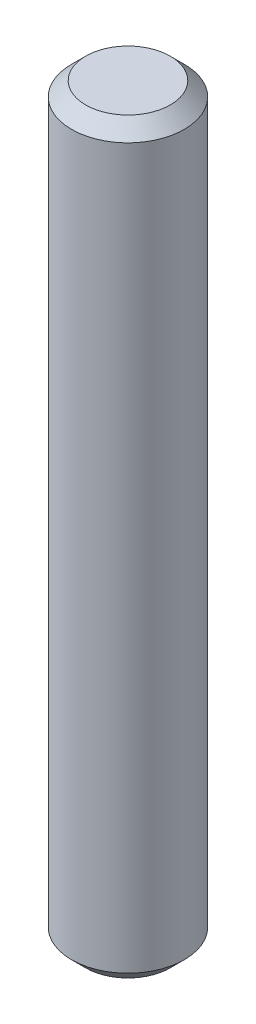
from build123d import *

# Parameters (mm, degrees)
SKETCH1_R           = 4
BOSS_EXTRUDE1_DEPTH = 53
CHAMFER1_SIZE       = 1


with BuildPart() as part:
    # Sketch1 → Boss-Extrude1 (new body)
    with BuildSketch(Plane(origin=(0, 0, 0), x_dir=(1, 0, 0), z_dir=(0, 1, 0))):
        with Locations(Location((0, 0, 0), (0, 0, 270))):
            Circle(SKETCH1_R)
    extrude(amount=BOSS_EXTRUDE1_DEPTH)

    # Chamfer1
    chamfer1_edges = [part.edges().sort_by_distance(p)[0] for p in [
        (0, 0, -4),
        (0, 53, -4),
    ]]
    chamfer(chamfer1_edges, length=CHAMFER1_SIZE)


solid = part.part
